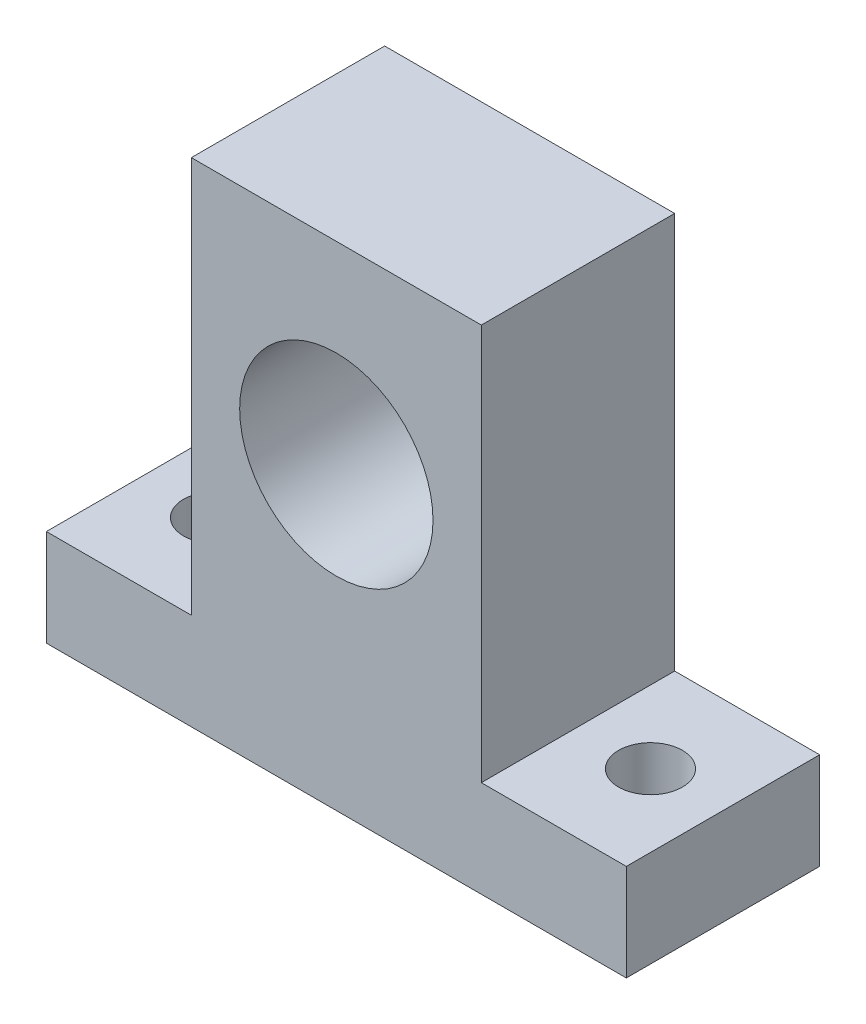
from build123d import *

# Parameters (mm, degrees)
SKETCH_1_R               = 10
EXTRUDE_1_DEPTH          = 20
CUT_EXTRUDE_1_DEPTH      = 55.598534779
CUT_EXTRUDE_1_DEPTH_BACK = 55.598534779
SKETCH_2_R               = 3.3


with BuildPart() as part:
    # 草图1 → 凸台-拉伸1 (new body)
    with BuildSketch(Plane.XY):
        Polygon((-15, 51), (15, 51), (15, 10), (30, 10), (30, 0), (-30, 0), (-30, 10), (-15, 10), align=None)
        with Locations((0, 31)):
            Circle(SKETCH_1_R, mode=Mode.SUBTRACT)
    extrude(amount=EXTRUDE_1_DEPTH)

    # 草图2 → 切除-拉伸1 (cut, two sides: drawn at the far end of the back side and taken through both)
    with BuildSketch(Plane(origin=(0, 10, 0), x_dir=(1, 0, 0), z_dir=(0, 1, 0)).offset(-CUT_EXTRUDE_1_DEPTH_BACK)):
        with Locations(Location((-22.5, -10, 0), (0, 0, 180))):
            Circle(SKETCH_2_R)
        with Locations(Location((22.5, -10, 0), (0, 0, 90))):
            Circle(SKETCH_2_R)
    extrude(amount=CUT_EXTRUDE_1_DEPTH + CUT_EXTRUDE_1_DEPTH_BACK, mode=Mode.SUBTRACT)


solid = part.part
